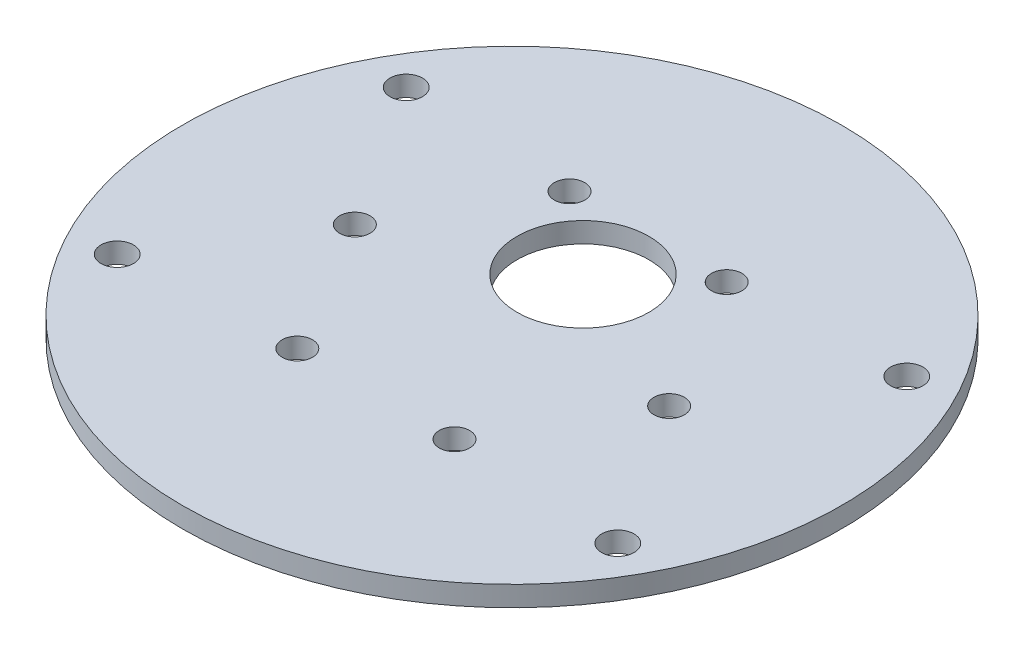
from build123d import *

# Parameters (mm, degrees)
SKETCH_1_R      = 32.5
SKETCH_1_R_2    = 1.6
SKETCH_1_R_3    = 6.5
SKETCH_1_R_4    = 1.5
EXTRUDE_1_DEPTH = 2


with BuildPart() as part:
    # 草图1 → 凸台-拉伸1 (new body)
    with BuildSketch(Plane(origin=(0, 0, 0), x_dir=(1, 0, 0), z_dir=(0, 1, 0))):
        with Locations(Location((0, 0, 0), (0, 0, 270))):
            Circle(SKETCH_1_R)
        with Locations(Location((-24.681724008, -14.25, 0), (0, 0, 90))):
            Circle(SKETCH_1_R_2, mode=Mode.SUBTRACT)
        with Locations(Location((0, 7, 0), (0, 0, 270))):
            Circle(SKETCH_1_R_3, mode=Mode.SUBTRACT)
        with Locations(Location((24.681724008, 14.25, 0), (0, 0, 90))):
            Circle(SKETCH_1_R_2, mode=Mode.SUBTRACT)
        with Locations(Location((24.681724008, -14.25, 0), (0, 0, 270))):
            Circle(SKETCH_1_R_2, mode=Mode.SUBTRACT)
        with Locations(Location((-24.681724008, 14.25, 0), (0, 0, 270))):
            Circle(SKETCH_1_R_2, mode=Mode.SUBTRACT)
        with Locations(Location((15.5, 0, 0), (0, 0, 270))):
            Circle(SKETCH_1_R_4, mode=Mode.SUBTRACT)
        with Locations(Location((7.75, -13.423393759, 0), (0, 0, 270))):
            Circle(SKETCH_1_R_4, mode=Mode.SUBTRACT)
        with Locations(Location((-7.75, -13.423393759, 0), (0, 0, 270))):
            Circle(SKETCH_1_R_4, mode=Mode.SUBTRACT)
        with Locations(Location((-15.5, 0, 0), (0, 0, 270))):
            Circle(SKETCH_1_R_4, mode=Mode.SUBTRACT)
        with Locations(Location((-7.75, 13.423393759, 0), (0, 0, 270))):
            Circle(SKETCH_1_R_4, mode=Mode.SUBTRACT)
        with Locations(Location((7.75, 13.423393759, 0), (0, 0, 270))):
            Circle(SKETCH_1_R_4, mode=Mode.SUBTRACT)
    extrude(amount=EXTRUDE_1_DEPTH)


solid = part.part
